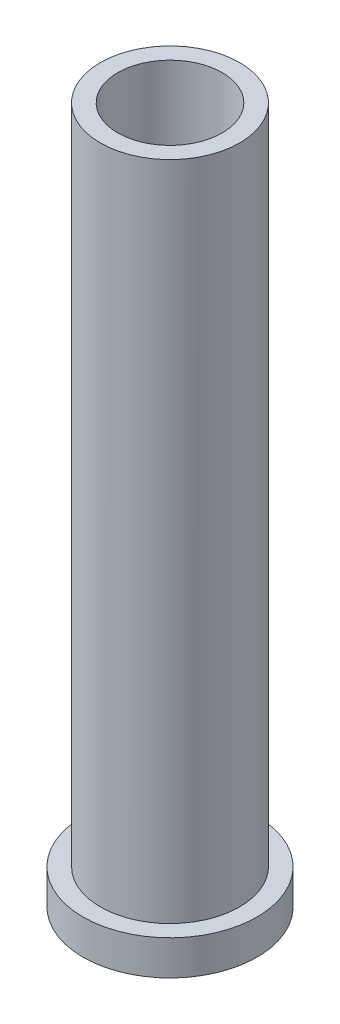
from build123d import *

# Parameters (mm, degrees)
SKETCH1_R           = 4
BOSS_EXTRUDE1_DEPTH = 38
SKETCH2_R           = 5
BOSS_EXTRUDE2_DEPTH = 2
SKETCH3_R           = 3
CUT_EXTRUDE1_DEPTH  = 41


with BuildPart() as part:
    # Sketch1 → Boss-Extrude1 (new body)
    with BuildSketch(Plane(origin=(0, 0, 0), x_dir=(1, 0, 0), z_dir=(0, 1, 0))):
        with Locations(Location((0, 0, 0), (0, 0, 270))):
            Circle(SKETCH1_R)
    extrude(amount=BOSS_EXTRUDE1_DEPTH)

    # Sketch2 → Boss-Extrude2 (add)
    with BuildSketch(Plane.XZ):
        with Locations(Location((0, 0, 0), (0, 0, 270))):
            Circle(SKETCH2_R)
    extrude(amount=BOSS_EXTRUDE2_DEPTH)

    # Sketch3 → Cut-Extrude1 (cut)
    with BuildSketch(Plane(origin=(0, 38, 0), x_dir=(1, 0, 0), z_dir=(0, 1, 0))):
        with Locations(Location((0, 0, 0), (0, 0, 270))):
            Circle(SKETCH3_R)
    extrude(amount=-CUT_EXTRUDE1_DEPTH, mode=Mode.SUBTRACT)


solid = part.part
